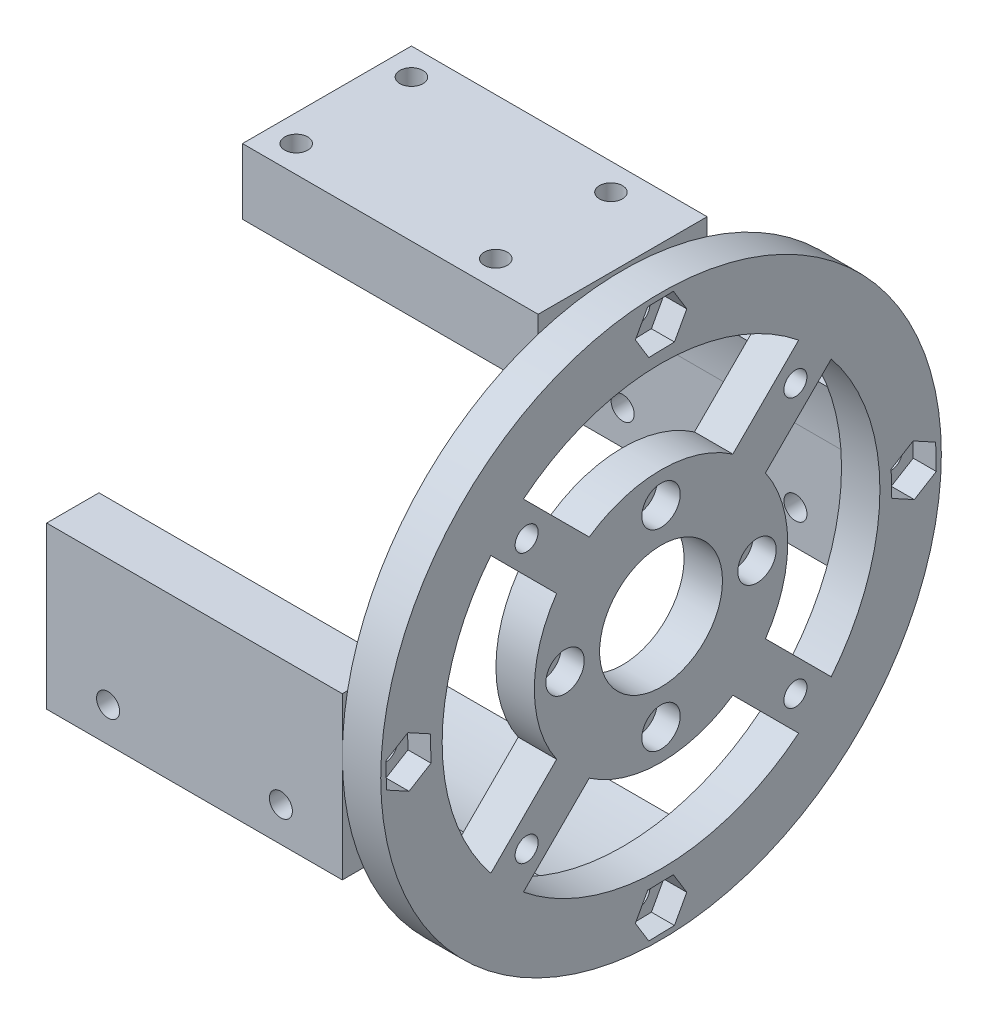
from build123d import *

# Parameters (mm, degrees)
SKETCH_1_R               = 36.5
SKETCH_1_R_2             = 1.55
SKETCH_1_R_3             = 8
EXTRUDE_1_DEPTH          = 5
CUT_EXTRUDE_2_REACH      = 53.86
SKETCH_5_R               = 1.55
CUT_EXTRUDE_3_REACH      = 53.86
SKETCH_7_R               = 1.55
CUT_EXTRUDE_4_DEPTH      = 3
SKETCH_10_R              = 1.5
CUT_EXTRUDE_5_DEPTH      = 5
PATTERN_CIRCULAR_1_COUNT = 4
SKETCH_11_W              = 22
SKETCH_11_H              = 8.54
EXTRUDE_4_DEPTH          = 38.5
SKETCH_12_W              = 8
SKETCH_12_H              = 21
EXTRUDE_5_DEPTH          = 38.5
EXTRUDE_6_DEPTH          = 38.5
SKETCH_15_R              = 1.55
CUT_EXTRUDE_6_DEPTH      = 45
SKETCH_16_R              = 1.554089707
SKETCH_16_R_2            = 1.55
CUT_EXTRUDE_7_DEPTH      = 45
SKETCH_17_R              = 1.5
CUT_EXTRUDE_8_DEPTH      = 10
SKETCH_18_R              = 1.5
CUT_EXTRUDE_9_DEPTH      = 10
CUT_EXTRUDE_START        = -10
SKETCH_19_R              = 1.5
CUT_EXTRUDE_10_DEPTH     = 10
SKETCH_20_R              = 2.5
CUT_EXTRUDE_11_DEPTH     = 4
SKETCH_21_R              = 2.5
CUT_EXTRUDE_12_DEPTH     = 3
SKETCH_23_R              = 30.5
CUT_EXTRUDE_13_DEPTH     = 41
CUT_EXTRUDE_15_DEPTH     = 65.702871768


with BuildPart() as part:
    # 草图1 → 凸台-拉伸1 (new body)
    with BuildSketch(Plane(origin=(0, 0, 0), x_dir=(0, 0, -1), z_dir=(1, 0, 0))):
        Circle(SKETCH_1_R)
        with Locations((0, 12.5)):
            Circle(SKETCH_1_R_2, mode=Mode.SUBTRACT)
        with Locations((12.5, 0)):
            Circle(SKETCH_1_R_2, mode=Mode.SUBTRACT)
        with Locations((0, -12.5)):
            Circle(SKETCH_1_R_2, mode=Mode.SUBTRACT)
        with Locations((-12.5, 0)):
            Circle(SKETCH_1_R_2, mode=Mode.SUBTRACT)
        Circle(SKETCH_1_R_3, mode=Mode.SUBTRACT)
        with BuildLine():
            Line((13.594114249, 9.351473562), (22.161904167, 17.91926348))
            ThreePointArc((22.161904167, 17.91926348), (28.5, 0), (22.161904167, -17.91926348))
            Line((22.161904167, -17.91926348), (13.594114249, -9.351473562))
            ThreePointArc((13.594114249, -9.351473562), (16.5, 0), (13.594114249, 9.351473562))
        make_face(mode=Mode.SUBTRACT)
        with BuildLine():
            Line((9.351473562, 13.594114249), (17.91926348, 22.161904167))
            ThreePointArc((17.91926348, 22.161904167), (0, 28.5), (-17.91926348, 22.161904167))
            Line((-17.91926348, 22.161904167), (-9.351473562, 13.594114249))
            ThreePointArc((-9.351473562, 13.594114249), (0, 16.5), (9.351473562, 13.594114249))
        make_face(mode=Mode.SUBTRACT)
        with BuildLine():
            Line((9.351473562, -13.594114249), (17.91926348, -22.161904167))
            ThreePointArc((17.91926348, -22.161904167), (0, -28.5), (-17.91926348, -22.161904167))
            Line((-17.91926348, -22.161904167), (-9.351473562, -13.594114249))
            ThreePointArc((-9.351473562, -13.594114249), (0, -16.5), (9.351473562, -13.594114249))
        make_face(mode=Mode.SUBTRACT)
        with BuildLine():
            Line((-13.594114249, -9.351473562), (-22.161904167, -17.91926348))
            ThreePointArc((-22.161904167, -17.91926348), (-28.5, 0), (-22.161904167, 17.91926348))
            Line((-22.161904167, 17.91926348), (-13.594114249, 9.351473562))
            ThreePointArc((-13.594114249, 9.351473562), (-16.5, 0), (-13.594114249, -9.351473562))
        make_face(mode=Mode.SUBTRACT)
    extrude(amount=-EXTRUDE_1_DEPTH)

    # 草图5 → 切除-拉伸2 (cut, up to next)
    with BuildSketch(Plane(origin=(0, 0, 0), x_dir=(0, 0, -1), z_dir=(1, 0, 0)), mode=Mode.PRIVATE) as cut_extrude_2_sk1:
        with Locations((-0.006483679, -32.906479867)):
            Circle(SKETCH_5_R)
    cut_extrude_2_tool1 = extrude(cut_extrude_2_sk1.sketch, amount=-CUT_EXTRUDE_2_REACH, mode=Mode.PRIVATE) & part.part
    # 草图5 → 切除-拉伸2 (cut, up to next)
    with BuildSketch(Plane(origin=(0, 0, 0), x_dir=(0, 0, -1), z_dir=(1, 0, 0)), mode=Mode.PRIVATE) as cut_extrude_2_sk2:
        with Locations((-32.9, 0)):
            Circle(SKETCH_5_R)
    cut_extrude_2_tool2 = extrude(cut_extrude_2_sk2.sketch, amount=-CUT_EXTRUDE_2_REACH, mode=Mode.PRIVATE) & part.part
    # 草图5 → 切除-拉伸2 (cut, up to next)
    with BuildSketch(Plane(origin=(0, 0, 0), x_dir=(0, 0, -1), z_dir=(1, 0, 0)), mode=Mode.PRIVATE) as cut_extrude_2_sk3:
        with Locations((0.006479867, 32.893516321)):
            Circle(SKETCH_5_R)
    cut_extrude_2_tool3 = extrude(cut_extrude_2_sk3.sketch, amount=-CUT_EXTRUDE_2_REACH, mode=Mode.PRIVATE) & part.part
    # 草图5 → 切除-拉伸2 (cut, up to next)
    with BuildSketch(Plane(origin=(0, 0, 0), x_dir=(0, 0, -1), z_dir=(1, 0, 0)), mode=Mode.PRIVATE) as cut_extrude_2_sk4:
        with Locations((32.899996188, -0.012963547)):
            Circle(SKETCH_5_R)
    cut_extrude_2_tool4 = extrude(cut_extrude_2_sk4.sketch, amount=-CUT_EXTRUDE_2_REACH, mode=Mode.PRIVATE) & part.part
    add(cut_extrude_2_tool1.solids().sort_by_distance((0, -32.90648, 0.006484))[0], mode=Mode.SUBTRACT)
    add(cut_extrude_2_tool2.solids().sort_by_distance((0, 0, 32.9))[0], mode=Mode.SUBTRACT)
    add(cut_extrude_2_tool3.solids().sort_by_distance((0, 32.893516, -0.00648))[0], mode=Mode.SUBTRACT)
    add(cut_extrude_2_tool4.solids().sort_by_distance((0, -0.012964, -32.899996))[0], mode=Mode.SUBTRACT)

    # 草图7 → 切除-拉伸3 (cut, up to next)
    with BuildSketch(Plane(origin=(0, 0, 0), x_dir=(0, 0, -1), z_dir=(1, 0, 0)), mode=Mode.PRIVATE) as cut_extrude_3_sk1:
        with Locations((9.1971e-05, -32.90647921)):
            Circle(SKETCH_7_R)
    cut_extrude_3_tool1 = extrude(cut_extrude_3_sk1.sketch, amount=-CUT_EXTRUDE_3_REACH, mode=Mode.PRIVATE) & part.part
    add(cut_extrude_3_tool1.solids().sort_by_distance((0, -32.906479, -9.2e-05))[0], mode=Mode.SUBTRACT)

    # 草图8 → 切除-拉伸4 (cut)
    with BuildSketch(Plane(origin=(0, 0, 0), x_dir=(0, 0, -1), z_dir=(1, 0, 0))):
        Polygon((35.836823617, -1.606256173), (35.757341789, 1.738938409), (32.820577385, 3.342702418), (29.963294811, 1.601271844), (30.042776639, -1.743922738), (32.979541042, -3.347686747), align=None)
        Polygon((3.35167445, 32.972998149), (1.610243876, 35.830280724), (-1.734950706, 35.750798895), (-3.338714715, 32.814034492), (-1.597284141, 29.956751917), (1.747910441, 30.036233746), align=None)
        Polygon((-1.59971328, -35.832835914), (1.745481303, -35.753354086), (3.349245312, -32.816589682), (1.607814738, -29.959307107), (-1.737379845, -30.038788936), (-3.341143854, -32.975553339), align=None)
        Polygon((-35.826293021, 1.603700983), (-35.746811192, -1.7414936), (-32.810046789, -3.345257608), (-29.952764214, -1.603827035), (-30.032246042, 1.741367548), (-32.969010446, 3.345131557), align=None)
    extrude(amount=-CUT_EXTRUDE_4_DEPTH, mode=Mode.SUBTRACT)

    # 草图10 → 切除-拉伸5 (cut)
    with BuildSketch(Plane(origin=(0, 0, 0), x_dir=(0, 0, -1), z_dir=(1, 0, 0))):
        with Locations((-17.5, 17.5)):
            Circle(SKETCH_10_R)
    cut_extrude_5 = extrude(amount=-CUT_EXTRUDE_5_DEPTH, mode=Mode.SUBTRACT)

    # 阵列(圆周)1: 切除-拉伸5 ×4 about axis
    pattern_circular_1_axis = Axis((0, 0, 0), (1, 0, 0))
    for i in range(1, PATTERN_CIRCULAR_1_COUNT):
        add(cut_extrude_5.rotate(pattern_circular_1_axis, i * 360 / PATTERN_CIRCULAR_1_COUNT), mode=Mode.SUBTRACT)

    # 草图11 → 凸台-拉伸4 (add)
    with BuildSketch(Plane.ZY.offset(5)):
        with Locations((0, 32.77)):
            Rectangle(SKETCH_11_W, SKETCH_11_H)
    extrude(amount=EXTRUDE_4_DEPTH)

    # 草图12 → 凸台-拉伸5 (add)
    with BuildSketch(Plane.ZY.offset(5)):
        with Locations((-32.5, -3.5)):
            Rectangle(SKETCH_12_W, SKETCH_12_H)
        with Locations((32.5, -3.5)):
            Rectangle(SKETCH_12_W, SKETCH_12_H)
    extrude(amount=EXTRUDE_5_DEPTH)

    # 草图13 → 凸台-拉伸6 (add)
    with BuildSketch(Plane.ZY.offset(5)):
        with BuildLine():
            Line((-7.188400395, -27.578558696), (-9.206196997, -35.319908506))
            ThreePointArc((-9.206196997, -35.319908506), (0, -36.5), (9.206196997, -35.319908506))
            Line((9.206196997, -35.319908506), (7.188400395, -27.578558696))
            ThreePointArc((7.188400395, -27.578558696), (0, -28.5), (-7.188400395, -27.578558696))
        make_face()
    extrude(amount=EXTRUDE_6_DEPTH)

    # 草图15 → 切除-拉伸6 (cut)
    with BuildSketch(Plane(origin=(0, 0, 0), x_dir=(0, 0, -1), z_dir=(1, 0, 0))):
        with Locations((-32.9, 0)):
            Circle(SKETCH_15_R)
    extrude(amount=-CUT_EXTRUDE_6_DEPTH, mode=Mode.SUBTRACT)

    # 草图16 → 切除-拉伸7 (cut)
    with BuildSketch(Plane(origin=(0, 0, 0), x_dir=(0, 0, -1), z_dir=(1, 0, 0))):
        with Locations((-0.003195611, -32.908911803)):
            Circle(SKETCH_16_R)
        with Locations((32.899996188, -0.012963547)):
            Circle(SKETCH_16_R_2)
        with Locations((0.006479867, 32.893516321)):
            Circle(SKETCH_16_R_2)
    extrude(amount=-CUT_EXTRUDE_7_DEPTH, mode=Mode.SUBTRACT)

    # 草图17 → 切除-拉伸8 (cut)
    with BuildSketch(Plane(origin=(0, 37.04, 0), x_dir=(1, 0, 0), z_dir=(0, 1, 0))):
        with Locations(Location((-40, 7.5, 0), (0, 0, 270))):
            Circle(SKETCH_17_R)
        with Locations(Location((-14.02, 7.5, 0), (0, 0, 270))):
            Circle(SKETCH_17_R)
        with Locations(Location((-40, -7.5, 0), (0, 0, 270))):
            Circle(SKETCH_17_R)
        with Locations(Location((-14.02, -7.5, 0), (0, 0, 270))):
            Circle(SKETCH_17_R)
    extrude(amount=-CUT_EXTRUDE_8_DEPTH, mode=Mode.SUBTRACT)

    # 草图18 → 切除-拉伸9 (cut)
    with BuildSketch(Plane(origin=(0, 0, -36.5), x_dir=(-1, 0, 0), z_dir=(0, 0, -1))):
        with Locations((13, -9.5)):
            Circle(SKETCH_18_R)
        with Locations((35.5, -9.5)):
            Circle(SKETCH_18_R)
    extrude(amount=-CUT_EXTRUDE_9_DEPTH, mode=Mode.SUBTRACT)

    # 草图19 → 切除-拉伸10 (cut)
    with BuildSketch(Plane.XY.offset(36.5).offset(CUT_EXTRUDE_START)):
        with Locations(Location((-35.5, -9.5, 0), (0, 0, 180))):
            Circle(SKETCH_19_R)
        with Locations(Location((-13, -9.5, 0), (0, 0, 180))):
            Circle(SKETCH_19_R)
    extrude(amount=CUT_EXTRUDE_10_DEPTH, mode=Mode.SUBTRACT)

    # 草图20 → 切除-拉伸11 (cut)
    with BuildSketch(Plane.XZ.offset(-28.5)):
        with Locations(Location((-40, 7.5, 0), (0, 0, 270))):
            Circle(SKETCH_20_R)
        with Locations(Location((-14.02, 7.5, 0), (0, 0, 270))):
            Circle(SKETCH_20_R)
        with Locations(Location((-14.02, -7.5, 0), (0, 0, 270))):
            Circle(SKETCH_20_R)
        with Locations(Location((-40, -7.5, 0), (0, 0, 270))):
            Circle(SKETCH_20_R)
    extrude(amount=-CUT_EXTRUDE_11_DEPTH, mode=Mode.SUBTRACT)

    # 草图21 → 切除-拉伸12 (cut)
    with BuildSketch(Plane(origin=(0, 0, 0), x_dir=(0, 0, -1), z_dir=(1, 0, 0))):
        with Locations((-12.5, 0)):
            Circle(SKETCH_21_R)
        with Locations((12.5, 0)):
            Circle(SKETCH_21_R)
        with Locations((0, 12.5)):
            Circle(SKETCH_21_R)
        with Locations((0, -12.5)):
            Circle(SKETCH_21_R)
    extrude(amount=-CUT_EXTRUDE_12_DEPTH, mode=Mode.SUBTRACT)

    # 草图23 → 切除-拉伸13 (cut)
    with BuildSketch(Plane.ZY.offset(5)):
        Circle(SKETCH_23_R)
    extrude(amount=CUT_EXTRUDE_13_DEPTH, mode=Mode.SUBTRACT)

    # 草图27 → 切除-拉伸15 (cut, through all)
    with BuildSketch(Plane.ZY.offset(5)):
        with BuildLine():
            Line((-30.5, 0), (-30.5, -14))
            Line((-30.5, -14), (-28.5, -14))
            Line((-28.5, -14), (-28.5, -10.862780491))
            ThreePointArc((-28.5, -10.862780491), (-29.995833044, -5.522680509), (-30.5, 0))
        make_face()
        with BuildLine():
            Line((30.5, 0), (30.5, -14))
            Line((30.5, -14), (28.5, -14))
            Line((28.5, -14), (28.5, -10.862780491))
            ThreePointArc((28.5, -10.862780491), (29.995833044, -5.522680509), (30.5, 0))
        make_face()
    extrude(amount=CUT_EXTRUDE_15_DEPTH, mode=Mode.SUBTRACT)


solid = part.part
